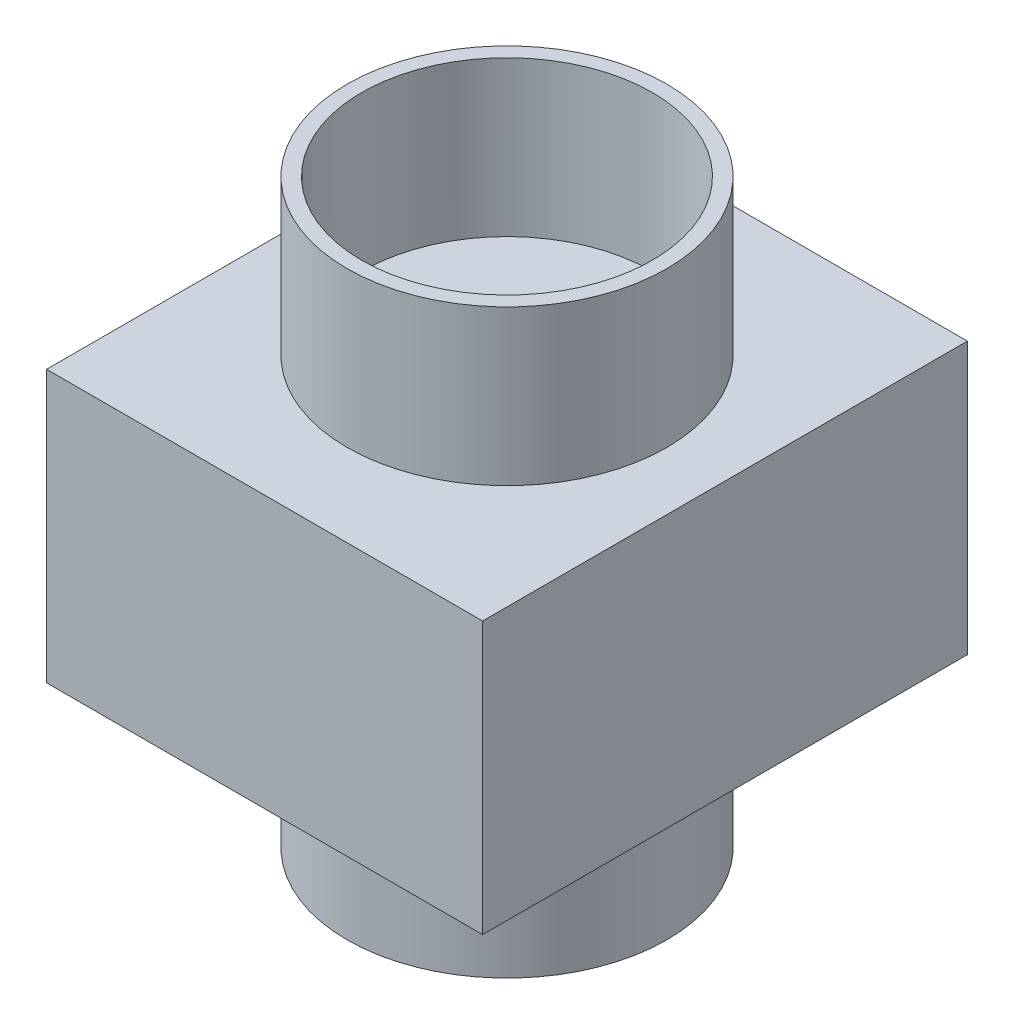
from build123d import *

# Parameters (mm, degrees)
SKETCH1_R           = 11
SKETCH1_R_2         = 10
BOSS_EXTRUDE1_DEPTH = 20
SKETCH2_W           = 33.358065124
SKETCH2_H           = 18.687210396
BOSS_EXTRUDE2_DEPTH = 15


with BuildPart() as part:
    # Sketch1 → Boss-Extrude1 (new, symmetric)
    with BuildSketch(Plane(origin=(0, 0, 0), x_dir=(1, 0, 0), z_dir=(0, 1, 0))):
        with Locations(Location((0, 0, 0), (0, 0, 270))):
            Circle(SKETCH1_R)
        with Locations(Location((0, 0, 0), (0, 0, 270))):
            Circle(SKETCH1_R_2, mode=Mode.SUBTRACT)
    extrude(amount=BOSS_EXTRUDE1_DEPTH, both=True)

    # Sketch2 → Boss-Extrude2 (add, symmetric)
    with BuildSketch(Plane(origin=(0, 0, 0), x_dir=(0, 0, -1), z_dir=(1, 0, 0))):
        Rectangle(SKETCH2_W, SKETCH2_H)
    extrude(amount=BOSS_EXTRUDE2_DEPTH, both=True)


solid = part.part
